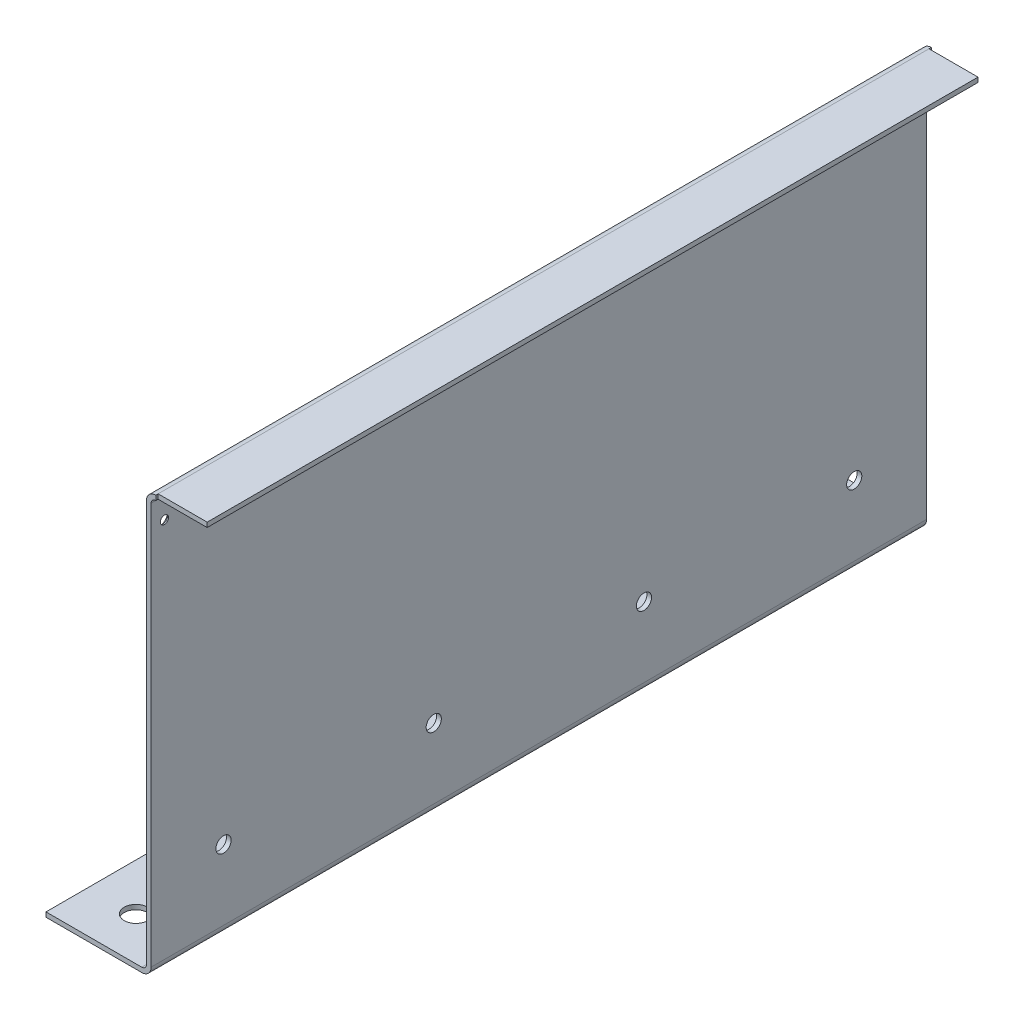
from build123d import *

# Parameters (mm, degrees)
EXTRUDE_1_DEPTH     = 332
SKETCH_2_R          = 3.25
CUT_EXTRUDE_1_DEPTH = 5
SKETCH_3_R          = 5
CUT_EXTRUDE_2_DEPTH = 5
SKETCH_4_W          = 26.179083289
SKETCH_4_H          = 3.25731829
CUT_EXTRUDE_3_DEPTH = 10
SKETCH_5_R          = 1.75
CUT_EXTRUDE_4_DEPTH = 2.5
CHAMFER_1_SIZE      = 1.5


with BuildPart() as part:
    # Эскиз1 → Вытянуть1 (new body)
    with BuildSketch(Plane.XY):
        with BuildLine():
            Line((-1, -68), (-1, 104))
            ThreePointArc((-1, 104), (0.171572875, 106.828427125), (3, 108))
            Line((3, 108), (24, 108))
            Line((24, 108), (24, 106))
            Line((24, 106), (3, 106))
            ThreePointArc((3, 106), (1.585786438, 105.414213562), (1, 104))
            Line((1, 104), (1, -68))
            ThreePointArc((1, -68), (-0.171572875, -70.828427125), (-3, -72))
            Line((-3, -72), (-44, -72))
            Line((-44, -72), (-44, -70))
            Line((-44, -70), (-3, -70))
            ThreePointArc((-3, -70), (-1.585786438, -69.414213562), (-1, -68))
        make_face()
    extrude(amount=EXTRUDE_1_DEPTH)

    # Эскиз2 → Вырез-Вытянуть1 (cut)
    with BuildSketch(Plane.ZY.offset(1)):
        with Locations((31, -38)):
            Circle(SKETCH_2_R)
        with Locations((121, -38)):
            Circle(SKETCH_2_R)
        with Locations((211, -38)):
            Circle(SKETCH_2_R)
        with Locations((301, -38)):
            Circle(SKETCH_2_R)
    extrude(amount=-CUT_EXTRUDE_1_DEPTH, mode=Mode.SUBTRACT)

    # Эскиз3 → Вырез-Вытянуть2 (cut)
    with BuildSketch(Plane(origin=(0, -70, 0), x_dir=(1, 0, 0), z_dir=(0, 1, 0))):
        with Locations(Location((-24, -18.5, 0), (0, 0, 270))):
            Circle(SKETCH_3_R)
        with Locations(Location((-24, -313.5, 0), (0, 0, 270))):
            Circle(SKETCH_3_R)
    extrude(amount=-CUT_EXTRUDE_2_DEPTH, mode=Mode.SUBTRACT)

    # Эскиз4 → Вырез-Вытянуть3 (cut)
    with BuildSketch(Plane(origin=(0, 108, 0), x_dir=(1, 0, 0), z_dir=(0, 1, 0))):
        with Locations((16.089541645, 0.628659145)):
            Rectangle(SKETCH_4_W, SKETCH_4_H)
        with Locations((16.089541645, -332.628659145)):
            Rectangle(SKETCH_4_W, SKETCH_4_H)
    extrude(amount=-CUT_EXTRUDE_3_DEPTH, mode=Mode.SUBTRACT)

    # Эскиз5 → Вырез-Вытянуть4 (cut)
    with BuildSketch(Plane.ZY.offset(1)):
        with Locations(Location((5.7, 95, 0), (0, 0, 270))):
            Circle(SKETCH_5_R)
        with Locations(Location((326.3, 95, 0), (0, 0, 270))):
            Circle(SKETCH_5_R)
    extrude(amount=-CUT_EXTRUDE_4_DEPTH, mode=Mode.SUBTRACT)

    # Фаска1
    chamfer_1_edges = [part.edges().sort_by_distance(p)[0] for p in [
        (-1, 96.75, 326.3),
        (-1, 96.75, 5.7),
    ]]
    chamfer(chamfer_1_edges, length=CHAMFER_1_SIZE)


solid = part.part
